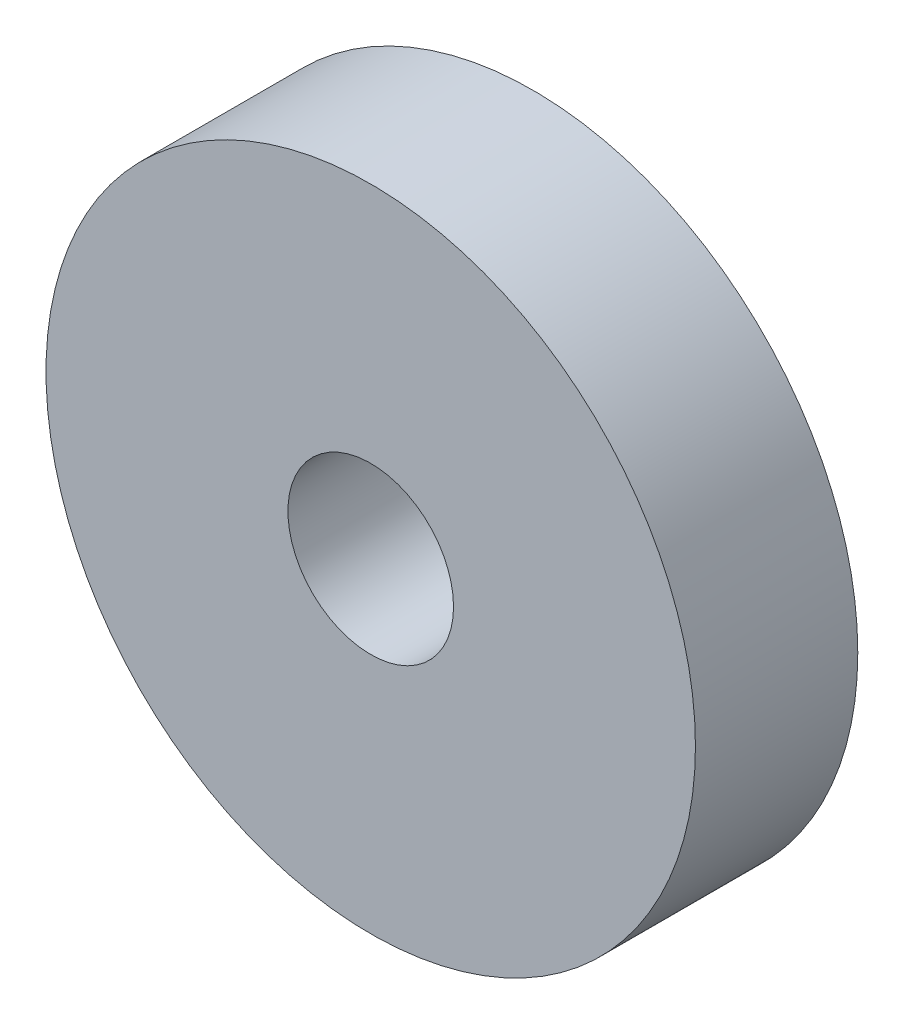
from build123d import *

# Parameters (mm, degrees)
SKETCH1_R           = 10
SKETCH1_R_2         = 2.55
BOSS_EXTRUDE1_DEPTH = 5


with BuildPart() as part:
    # Sketch1 → Boss-Extrude1 (new body)
    with BuildSketch(Plane.XY):
        Circle(SKETCH1_R)
        Circle(SKETCH1_R_2, mode=Mode.SUBTRACT)
    extrude(amount=BOSS_EXTRUDE1_DEPTH)


solid = part.part
